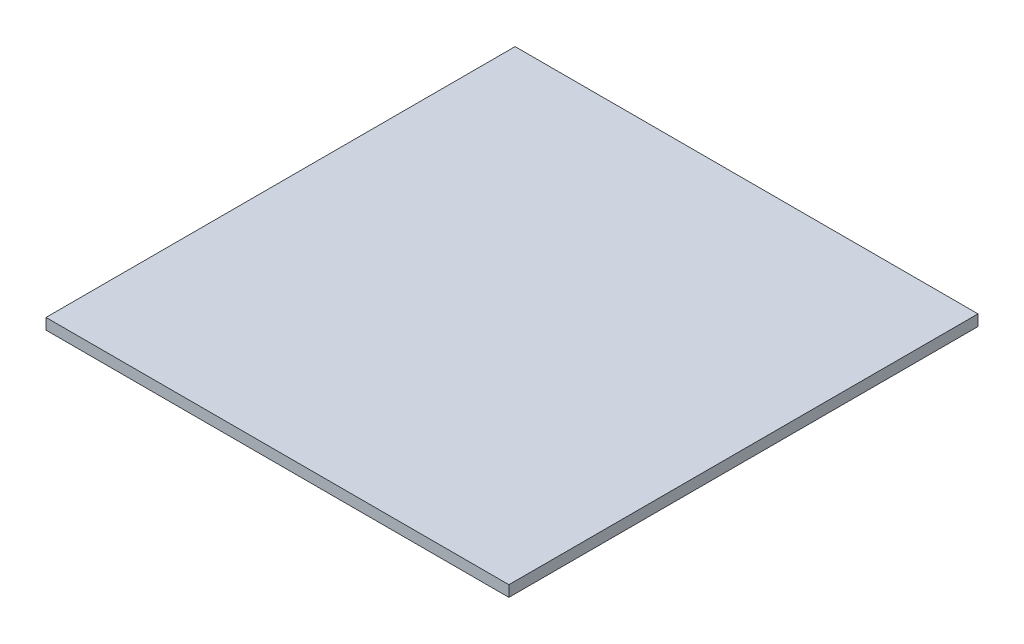
from build123d import *

# Parameters (mm, degrees)
ESQUISSE1_W        = 78.5
ESQUISSE1_H        = 79.55
BOSS_EXTRU_1_DEPTH = 1.87


with BuildPart() as part:
    # Esquisse1 → Boss.-Extru.1 (new body)
    with BuildSketch(Plane(origin=(0, 0, 0), x_dir=(1, 0, 0), z_dir=(0, 1, 0))):
        with Locations((39.25, 39.775)):
            Rectangle(ESQUISSE1_W, ESQUISSE1_H)
    extrude(amount=BOSS_EXTRU_1_DEPTH)


solid = part.part
